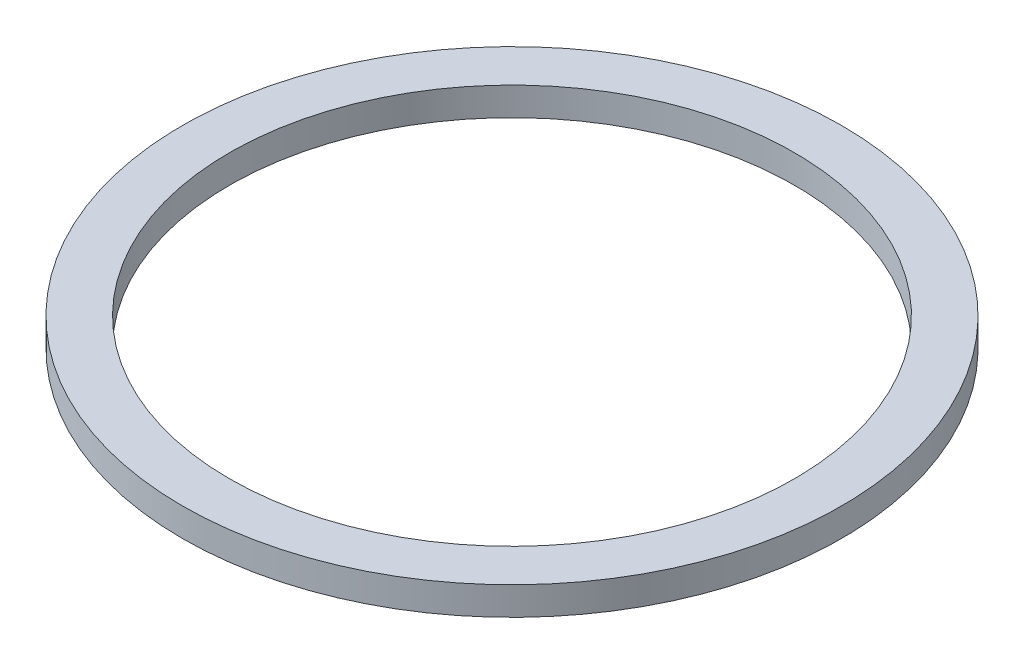
from build123d import *

# Parameters (mm, degrees)
SKETCH1_R           = 350
SKETCH1_R_2         = 300
BOSS_EXTRUDE1_DEPTH = 30


with BuildPart() as part:
    # Sketch1 → Boss-Extrude1 (new body)
    with BuildSketch(Plane(origin=(0, 0, 0), x_dir=(1, 0, 0), z_dir=(0, 1, 0))):
        with Locations(Location((0, 0, 0), (0, 0, 270))):
            Circle(SKETCH1_R)
        with Locations(Location((0, 0, 0), (0, 0, 270))):
            Circle(SKETCH1_R_2, mode=Mode.SUBTRACT)
    extrude(amount=BOSS_EXTRUDE1_DEPTH)


solid = part.part
